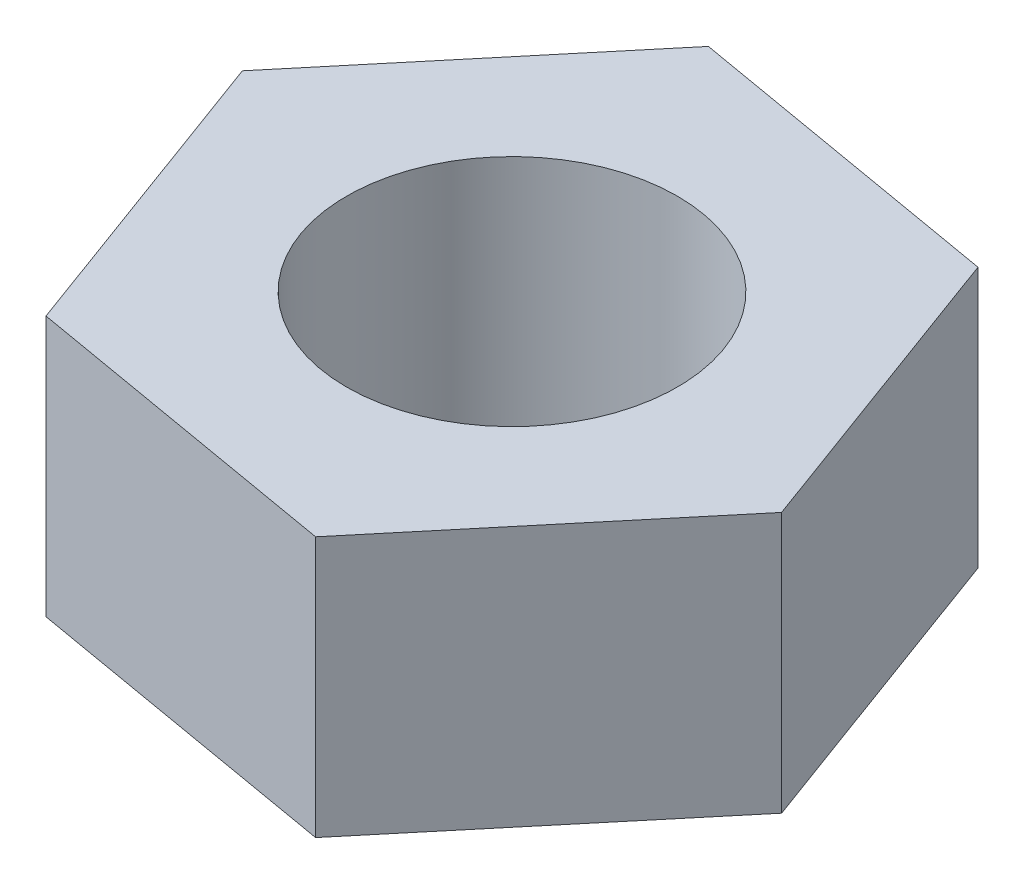
from build123d import *

# Parameters (mm, degrees)
SKETCH1_R           = 3.175
BOSS_EXTRUDE1_DEPTH = 5


with BuildPart() as part:
    # Sketch1 → Boss-Extrude1 (new body)
    with BuildSketch(Plane(origin=(0, 0, 0), x_dir=(1, 0, 0), z_dir=(0, 1, 0))):
        Polygon((-6.257853507, 1.082867865), (-4.066717833, -4.878026178), (2.191135674, -5.960894043), (6.257853507, -1.082867865), (4.066717833, 4.878026178), (-2.191135674, 5.960894043), align=None)
        with Locations(Location((0, 0, 0), (0, 0, 270))):
            Circle(SKETCH1_R, mode=Mode.SUBTRACT)
    extrude(amount=BOSS_EXTRUDE1_DEPTH)


solid = part.part
